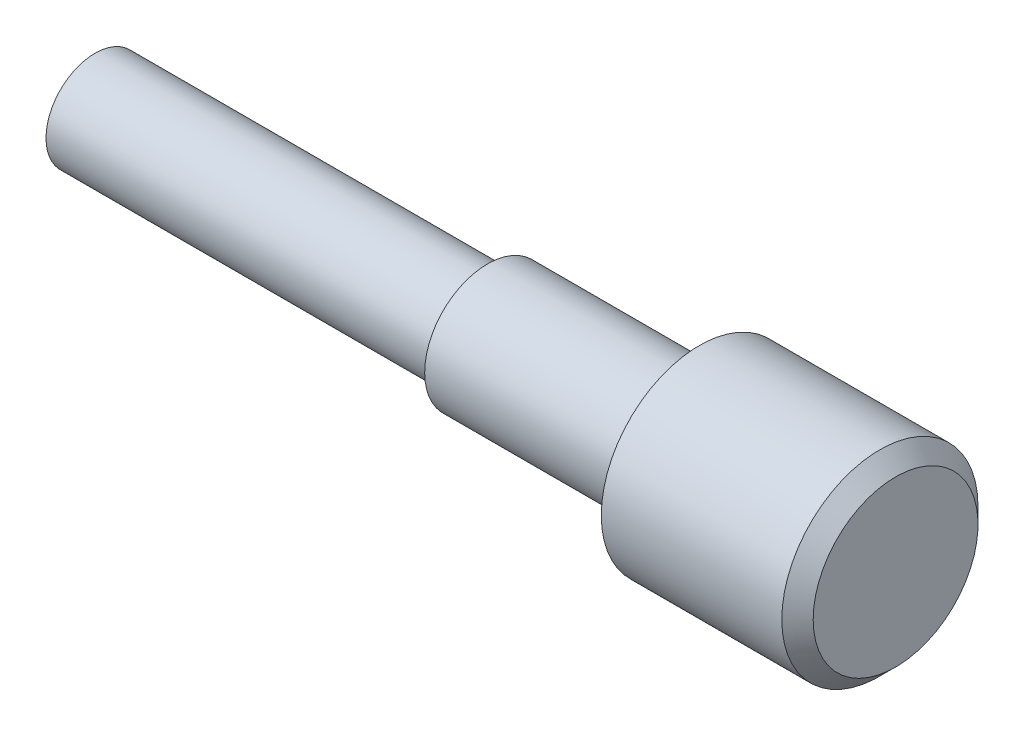
from build123d import *

# Parameters (mm, degrees)
CHAMFER1_SIZE = 0.254


with BuildPart() as part:
    # Sketch2 → Revolve1 (revolve)
    with BuildSketch(Plane(origin=(0, 0, 0), x_dir=(1, 0, 0), z_dir=(0, 1, 0)), mode=Mode.PRIVATE) as revolve1_sk:
        Polygon((-6.477, 0), (6.477, 0), (6.477, 1.5875), (3.302, 1.5875), (3.302, 1.016), (-0.127, 1.016), (-0.127, 0.79375), (-6.477, 0.79375), align=None)
    revolve(revolve1_sk.sketch.rotate(Axis((-6.477, 0, 0), (1, 0, 0)), 180), axis=Axis((-6.477, 0, 0), (1, 0, 0)))

    # Chamfer1
    chamfer1_edges = [part.edges().sort_by_distance(p)[0] for p in [
        (6.477, 0, -1.5875),
    ]]
    chamfer(chamfer1_edges, length=CHAMFER1_SIZE)


solid = part.part
